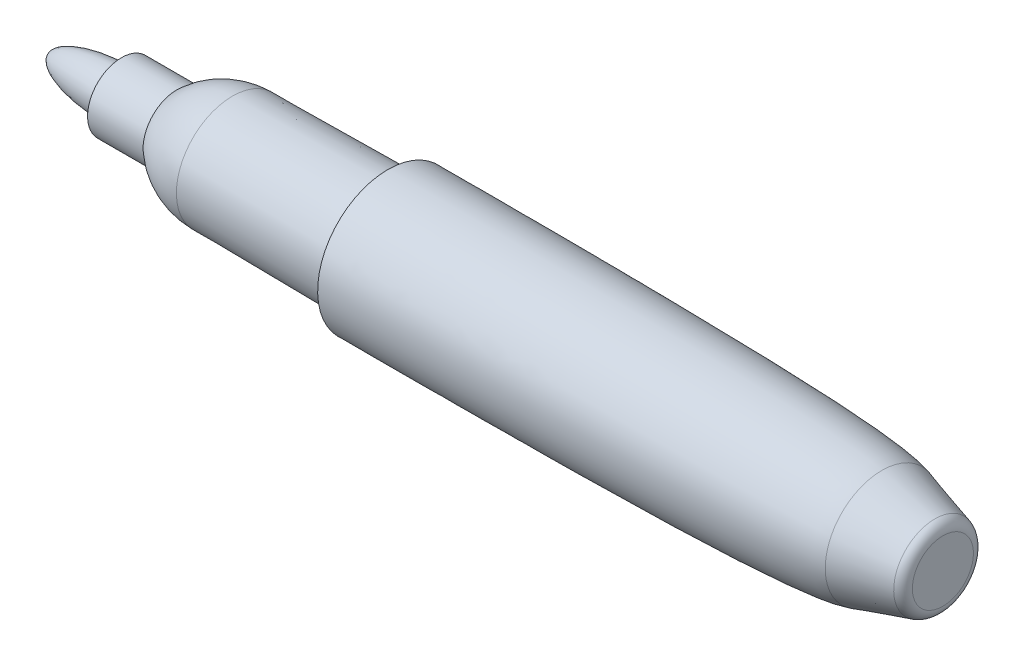
from build123d import *


with BuildPart() as part:
    # Sketch1 → Revolve1 (revolve)
    with BuildSketch(Plane.XY):
        with BuildLine():
            Line((0, 0), (-80.5, 0))
            add(Edge.make_bspline(
                [(-74, 2), (-80.5, 2), (-80.5, 0)],
                knots=[4.71238898, 4.71238898, 4.71238898, 6.283185307, 6.283185307, 6.283185307], degree=2, weights=[1, 0.707106781, 1]))
            Line((-74, 2), (-74, 3.05))
            Line((-74, 3.05), (-69, 3.05))
            ThreePointArc((-69, 3.05), (-66.68703246, 4.51758115), (-64, 5.05))
            Line((-64, 5.05), (-50, 5.2))
            Line((-50, 5.2), (-50, 6.325))
            add(Edge.make_bspline(
                [(-50, 6.325), (-26.936405274, 6.325), (-9.347344877, 6.218788302), (-5.5, 5.1)],
                knots=[0, 0, 0, 0, 0.970469824, 0.970469824, 0.970469824, 0.970469824], degree=3))
            Line((-5.5, 5.1), (-0.720771547, 3.710224698))
            ThreePointArc((-0.720771547, 3.710224698), (-0.200241145, 3.350321392), (0, 2.75))
            Line((0, 2.75), (0, 0))
        make_face()
    revolve(axis=Axis((0, 0, 0), (-1, 0, 0)))


solid = part.part
